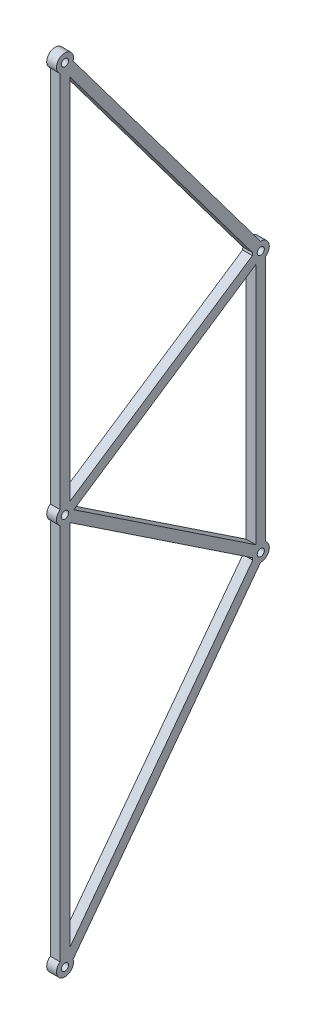
from build123d import *

# Parameters (mm, degrees)
BOSS_EXTRUDE1_DEPTH = 15
SKETCH3_R           = 13
BOSS_EXTRUDE2_DEPTH = 15
CUT_EXTRUDE1_DEPTH  = 15
SKETCH5_R           = 5.5
CUT_EXTRUDE2_DEPTH  = 15


with BuildPart() as part:
    # Sketch2 → Boss-Extrude1 (new body)
    with BuildSketch(Plane.YZ):
        with BuildLine():
            Line((600, 307.5), (-22.5, 307.5))
            Line((-22.5, 307.5), (395.5, -6))
            ThreePointArc((395.5, -6), (397.628291755, -7.115124735), (400, -7.5))
            Line((400, -7.5), (800, -7.5))
            ThreePointArc((800, -7.5), (802.371708245, -7.115124735), (804.5, -6))
            Line((804.5, -6), (1222.5, 307.5))
            Line((1222.5, 307.5), (600, 307.5))
        make_face()
        Polygon((414.013878189, 7.5), (600, 286.479182717), (785.986121811, 7.5), align=None, mode=Mode.SUBTRACT)
        Polygon((801.842585459, 10.756939094), (614.013878189, 292.5), (1177.5, 292.5), align=None, mode=Mode.SUBTRACT)
        Polygon((585.986121811, 292.5), (22.5, 292.5), (398.157414541, 10.756939094), align=None, mode=Mode.SUBTRACT)
    extrude(amount=BOSS_EXTRUDE1_DEPTH)

    # Sketch3 → Boss-Extrude2 (add)
    with BuildSketch(Plane.YZ.offset(15)):
        with Locations((400, 0)):
            Circle(SKETCH3_R)
        with Locations((0, 300)):
            Circle(SKETCH3_R)
        with Locations((600, 300)):
            Circle(SKETCH3_R)
        with Locations((1200, 300)):
            Circle(SKETCH3_R)
        with Locations((800, 0)):
            Circle(SKETCH3_R)
    extrude(amount=-BOSS_EXTRUDE2_DEPTH)

    # Sketch4 → Cut-Extrude1 (cut)
    with BuildSketch(Plane.YZ.offset(15)):
        with BuildLine():
            Line((-10.618380291, 307.5), (-22.5, 307.5))
            Line((-22.5, 307.5), (-12.994704233, 300.371028174))
            ThreePointArc((-12.994704233, 300.371028174), (-12.332882875, 304.110960958), (-10.618380291, 307.5))
        make_face()
        with BuildLine():
            Line((1210.618380291, 307.5), (1222.5, 307.5))
            Line((1222.5, 307.5), (1212.994704233, 300.371028174))
            ThreePointArc((1212.994704233, 300.371028174), (1212.332882875, 304.110960958), (1210.618380291, 307.5))
        make_face()
    extrude(amount=-CUT_EXTRUDE1_DEPTH, mode=Mode.SUBTRACT)

    # Sketch5 → Cut-Extrude2 (cut)
    with BuildSketch(Plane.YZ.offset(15)):
        with Locations(Location((0, 300, 0), (0, 0, 270))):
            Circle(SKETCH5_R)
        with Locations(Location((600, 300, 0), (0, 0, 270))):
            Circle(SKETCH5_R)
        with Locations(Location((1200, 300, 0), (0, 0, 270))):
            Circle(SKETCH5_R)
        with Locations(Location((800, 0, 0), (0, 0, 270))):
            Circle(SKETCH5_R)
        with Locations(Location((400, 0, 0), (0, 0, 270))):
            Circle(SKETCH5_R)
    extrude(amount=-CUT_EXTRUDE2_DEPTH, mode=Mode.SUBTRACT)


solid = part.part
